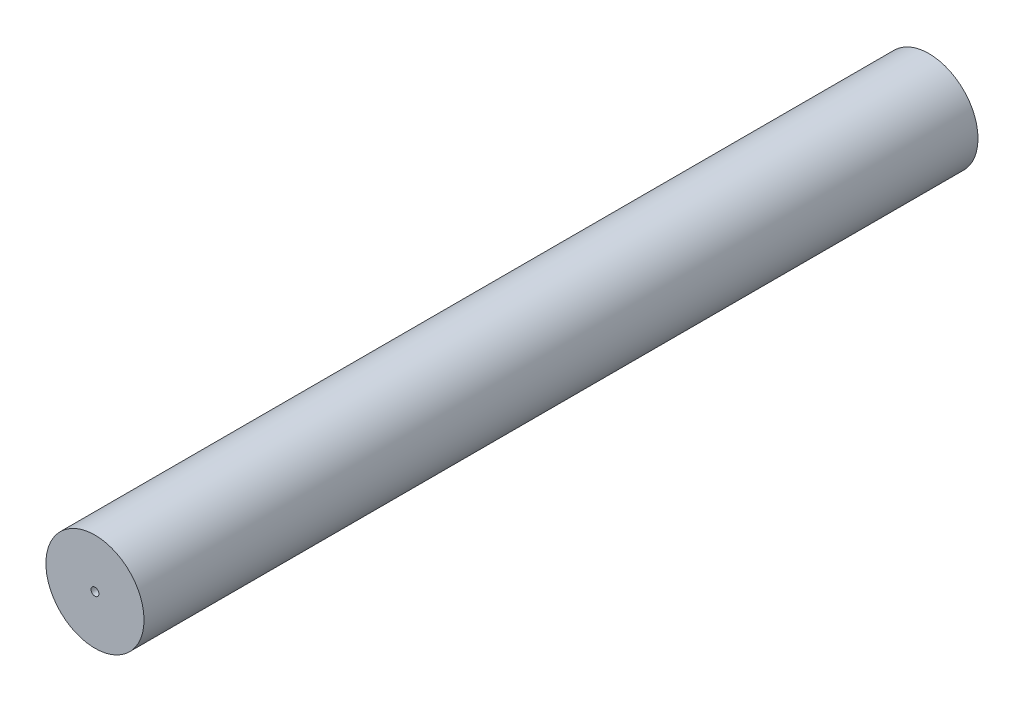
from build123d import *

# Parameters (mm, degrees)
SKETCH1_R           = 5
BOSS_EXTRUDE1_DEPTH = 85
SKETCH3_R           = 0.4
CUT_EXTRUDE2_DEPTH  = 86.293610546


with BuildPart() as part:
    # Sketch1 → Boss-Extrude1 (new body)
    with BuildSketch(Plane.XY):
        Circle(SKETCH1_R)
    extrude(amount=BOSS_EXTRUDE1_DEPTH)

    # Sketch3 → Cut-Extrude2 (cut, through all)
    with BuildSketch(Plane.XY.offset(85)):
        Circle(SKETCH3_R)
    extrude(amount=-CUT_EXTRUDE2_DEPTH, mode=Mode.SUBTRACT)


solid = part.part
